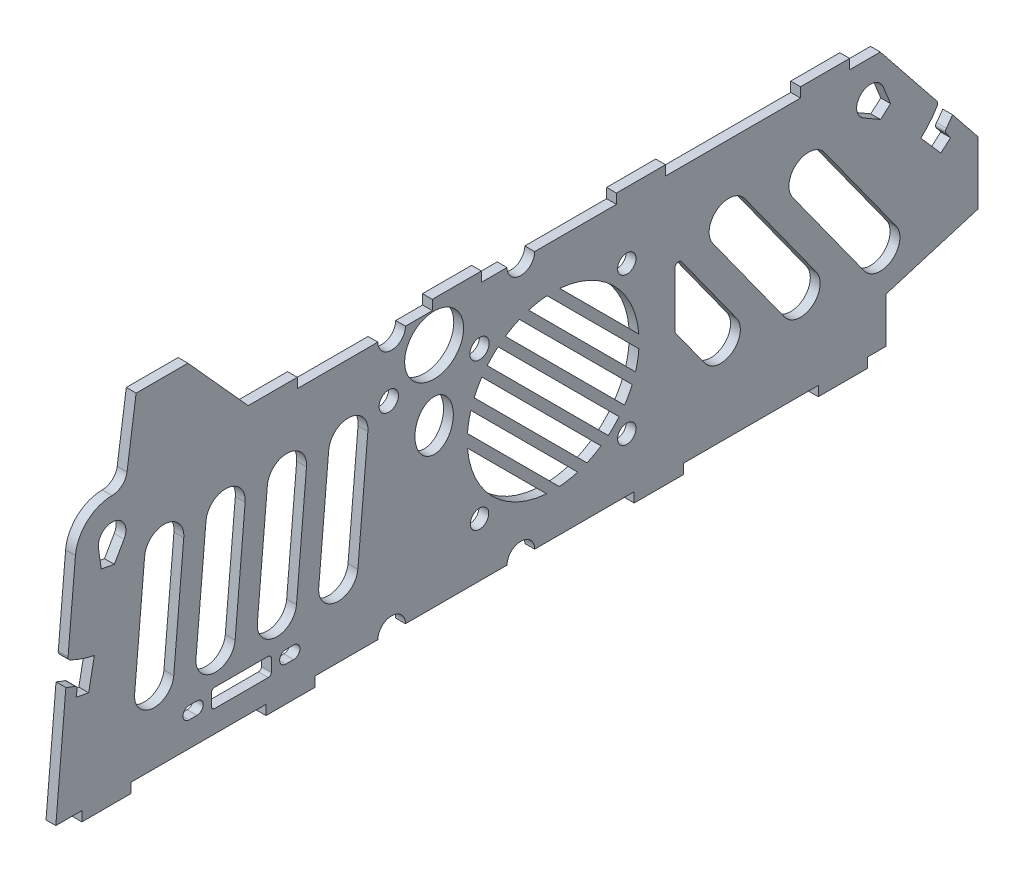
from build123d import *

# Parameters (mm, degrees)
EXTRUDE_1_DEPTH        = 1.6
SKETCH_2_W             = 8
SKETCH_2_H             = 1.6
EXTRUDE_3789_DEPTH     = 1.6
SKETCH_3901_R          = 1.575
SKETCH_3901_R_2        = 4.8
SKETCH_3901_RX         = 4.079397779
SKETCH_3901_RY         = 3.125
CUT_EXTRUDE_4345_DEPTH = 111.97882175
CUT_EXTRUDE_4991_DEPTH = 111.978821888
USB_C_DEPTH            = 111.978821888
SKETCH_4_R             = 1.5
CUT_EXTRUDE_6539_DEPTH = 111.978821888
FILLET_6578_R          = 0.6


with BuildPart() as part:
    # Sketch 258 → 凸台-拉伸1 (new body)
    with BuildSketch(Plane(origin=(0, 0, 0), x_dir=(0, 0, -1), z_dir=(1, 0, 0))):
        with BuildLine():
            Line((-95.02759931, 18.678130112), (-96.66172395, 0))
            Line((-96.66172395, 0), (-44.182229478, 0))
            ThreePointArc((-44.182229478, 0), (-41.932229478, 2.25), (-39.682229478, 0))
            Line((-39.682229478, 0), (-23.132229478, 0))
            ThreePointArc((-23.132229478, 0), (-20.882229478, 2.25), (-18.632229478, 0))
            Line((-18.632229478, 0), (38.58827605, 0))
            Line((38.58827605, 0), (38.58827605, 7.363667343))
            Line((38.58827605, 7.363667343), (53.613979238, 11.877821069))
            Line((53.613979238, 11.877821069), (53.613979238, 22.082386187))
            Line((53.613979238, 22.082386187), (49.47062371, 27.265958003))
            ThreePointArc((49.47062371, 27.265958003), (48.834122057, 26.360802519), (48.136507156, 25.501864655))
            Line((48.136507156, 25.501864655), (49.140587437, 24.184380908))
            Line((49.140587437, 24.184380908), (47.555615421, 22.806751165))
            Line((47.555615421, 22.806751165), (46.571594176, 23.938874033))
            Line((46.571594176, 23.938874033), (44.304779315, 26.546859335))
            ThreePointArc((44.304779315, 26.546859335), (45.901319607, 28.216879129), (47.163951689, 30.151735001))
            Line((47.163951689, 30.151735001), (38.58827605, 40.88038965))
            Line((38.58827605, 40.88038965), (37.693344157, 42))
            Line((37.693344157, 42), (-18.632229478, 42))
            ThreePointArc((-18.632229478, 42), (-20.882229478, 39.75), (-23.132229478, 42))
            Line((-23.132229478, 42), (-39.682229478, 42))
            ThreePointArc((-39.682229478, 42), (-41.932229478, 39.75), (-44.182229478, 42))
            Line((-44.182229478, 42), (-87.489213038, 42))
            ThreePointArc((-87.489213038, 42), (-91.542754284, 40.423664021), (-93.466381227, 36.522934456))
            Line((-93.466381227, 36.522934456), (-94.701678523, 22.403421746))
            ThreePointArc((-94.701678523, 22.403421746), (-92.600586212, 21.482408503), (-90.385935715, 20.883929203))
            Line((-90.385935715, 20.883929203), (-91.044661581, 17.446476624))
            Line((-91.044661581, 17.446476624), (-91.308151928, 16.071495593))
            Line((-91.308151928, 16.071495593), (-93.370623475, 16.466731113))
            Line((-93.370623475, 16.466731113), (-93.085096991, 17.956704104))
            ThreePointArc((-93.085096991, 17.956704104), (-94.06624713, 18.290763242), (-95.02759931, 18.678130112))
        make_face()
        with BuildLine():
            Line((-87.134291099, 32.113751112), (-88.194990752, 32.317015094))
            Line((-88.194990752, 32.317015094), (-89.255690405, 32.520279076))
            Line((-89.255690405, 32.520279076), (-89.715676025, 35.675403991))
            ThreePointArc((-89.715676025, 35.675403991), (-87.651937161, 38.244108032), (-85.239213038, 36))
            ThreePointArc((-85.239213038, 36), (-85.315834651, 35.417826153), (-85.540480938, 34.875303062))
            Line((-85.540480938, 34.875303062), (-87.134291099, 32.113751112))
        make_face(mode=Mode.SUBTRACT)
        with BuildLine():
            ThreePointArc((34.968023431, 34.04870964), (34.612244182, 37.698184303), (38.176585209, 36.837534989))
            Line((38.176585209, 36.837534989), (39.363457628, 33.878188125))
            Line((39.363457628, 33.878188125), (38.548329162, 33.169692829))
            Line((38.548329162, 33.169692829), (37.733200697, 32.461197532))
            Line((37.733200697, 32.461197532), (34.968023431, 34.04870964))
        make_face(mode=Mode.SUBTRACT)
    extrude(amount=EXTRUDE_1_DEPTH)

    # 草图2 → Extrude 3789 (add)
    with BuildSketch(Plane(origin=(0, 0, 0), x_dir=(0, 0, -1), z_dir=(1, 0, 0))):
        with Locations((31.58827605, -0.8)):
            Rectangle(SKETCH_2_W, SKETCH_2_H)
        with BuildLine():
            Line((-83.57773768, 54.5), (-85.058465214, 44.108922128))
            ThreePointArc((-85.058465214, 44.108922128), (-85.880169259, 42.600716396), (-87.489213038, 42))
            Line((-87.489213038, 42), (-65.306655843, 42))
            Line((-65.306655843, 42), (-57.306655843, 42))
            Line((-57.306655843, 42), (-57.306655843, 43.6))
            Line((-57.306655843, 43.6), (-65.306655843, 43.6))
            Line((-65.306655843, 43.6), (-75.139107316, 54.5))
            Line((-75.139107316, 54.5), (-83.57773768, 54.5))
        make_face()
        with Locations((1.58827605, -0.8)):
            Rectangle(SKETCH_2_W, SKETCH_2_H)
        with Locations((-58.41172395, -0.8)):
            Rectangle(SKETCH_2_W, SKETCH_2_H)
        with Locations((-88.41172395, -0.8)):
            Rectangle(SKETCH_2_W, SKETCH_2_H)
        with Locations((28.693344157, 42.8)):
            Rectangle(SKETCH_2_W, SKETCH_2_H)
        with Locations((-1.306655843, 42.8)):
            Rectangle(SKETCH_2_W, SKETCH_2_H)
        with Locations((-31.306655843, 42.8)):
            Rectangle(SKETCH_2_W, SKETCH_2_H)
    extrude(amount=EXTRUDE_3789_DEPTH)

    # Sketch 3901 → Cut-Extrude 4345 (cut, through all)
    with BuildSketch(Plane(origin=(1.6, 0, 0), x_dir=(0, 0, -1), z_dir=(1, 0, 0))):
        with Locations((-42.41172395, 32.797244765)):
            Circle(SKETCH_3901_R)
        with Locations((-27.61172395, 32.797244765)):
            Circle(SKETCH_3901_R)
        with Locations((-35.01172395, 37)):
            Circle(SKETCH_3901_R_2)
        with Locations(Location((-35.01172395, 25.645875517), (0, 0, 90))):
            Ellipse(SKETCH_3901_RX, SKETCH_3901_RY)
    extrude(amount=-CUT_EXTRUDE_4345_DEPTH, mode=Mode.SUBTRACT)

    # 草图3 → Cut-Extrude 4991 (cut, through all)
    with BuildSketch(Plane(origin=(1.6, 0, 0), x_dir=(0, 0, -1), z_dir=(1, 0, 0))):
        with BuildLine():
            Line((-75.812176966, 30.221101623), (-77.443840541, 11.571101623))
            ThreePointArc((-77.443840541, 11.571101623), (-80.910561952, 8.662176966), (-83.819486609, 12.128898377))
            Line((-83.819486609, 12.128898377), (-82.187823034, 30.778898377))
            ThreePointArc((-82.187823034, 30.778898377), (-78.721101623, 33.687823034), (-75.812176966, 30.221101623))
        make_face()
        with BuildLine():
            Line((28.597036742, 32.36959893), (40.282030055, 16.138119291))
            ThreePointArc((40.282030055, 16.138119291), (39.554592243, 11.671483618), (35.08795657, 12.398921431))
            Line((35.08795657, 12.398921431), (23.402963258, 28.63040107))
            ThreePointArc((23.402963258, 28.63040107), (24.13040107, 33.097036742), (28.597036742, 32.36959893))
        make_face()
        with BuildLine():
            Line((15.597036742, 32.36959893), (27.282030055, 16.138119291))
            ThreePointArc((27.282030055, 16.138119291), (26.554592243, 11.671483618), (22.08795657, 12.398921431))
            Line((22.08795657, 12.398921431), (10.402963258, 28.63040107))
            ThreePointArc((10.402963258, 28.63040107), (11.13040107, 33.097036742), (15.597036742, 32.36959893))
        make_face()
        with BuildLine():
            Line((-65.812176966, 30.221101623), (-67.443840541, 11.571101623))
            ThreePointArc((-67.443840541, 11.571101623), (-70.910561952, 8.662176966), (-73.819486609, 12.128898377))
            Line((-73.819486609, 12.128898377), (-72.187823034, 30.778898377))
            ThreePointArc((-72.187823034, 30.778898377), (-68.721101623, 33.687823034), (-65.812176966, 30.221101623))
        make_face()
        with BuildLine():
            Line((5.310202454, 28.600774008), (14.282030055, 16.138119291))
            ThreePointArc((14.282030055, 16.138119291), (13.554592243, 11.671483618), (9.08795657, 12.398921431))
            Line((9.08795657, 12.398921431), (4.336313675, 18.999369787))
            ThreePointArc((4.336313675, 18.999369787), (4.252221011, 19.16575476), (4.223258065, 19.349919586))
            Line((4.223258065, 19.349919586), (4.223258065, 28.250224209))
            ThreePointArc((4.223258065, 28.250224209), (4.639093238, 28.821261263), (5.310202454, 28.600774008))
        make_face()
        with BuildLine():
            Line((-55.812176966, 30.221101623), (-57.443840541, 11.571101623))
            ThreePointArc((-57.443840541, 11.571101623), (-60.910561952, 8.662176966), (-63.819486609, 12.128898377))
            Line((-63.819486609, 12.128898377), (-62.187823034, 30.778898377))
            ThreePointArc((-62.187823034, 30.778898377), (-58.721101623, 33.687823034), (-55.812176966, 30.221101623))
        make_face()
        with BuildLine():
            Line((-45.812176966, 30.221101623), (-47.443840541, 11.571101623))
            ThreePointArc((-47.443840541, 11.571101623), (-50.910561952, 8.662176966), (-53.819486609, 12.128898377))
            Line((-53.819486609, 12.128898377), (-52.187823034, 30.778898377))
            ThreePointArc((-52.187823034, 30.778898377), (-48.721101623, 33.687823034), (-45.812176966, 30.221101623))
        make_face()
    extrude(amount=-CUT_EXTRUDE_4991_DEPTH, mode=Mode.SUBTRACT)

    # Sketch1 → USB-C供电接口 (cut, through all)
    with BuildSketch(Plane(origin=(0, 0, 0), x_dir=(0, 0, -1), z_dir=(1, 0, 0))):
        with BuildLine():
            Line((-70.78672395, 6.588077), (-62.03672395, 6.588077))
            ThreePointArc((-62.03672395, 6.588077), (-61.68317056, 6.441630391), (-61.53672395, 6.088077))
            Line((-61.53672395, 6.088077), (-61.53672395, 4.088077))
            ThreePointArc((-61.53672395, 4.088077), (-61.68317056, 3.734523609), (-62.03672395, 3.588077))
            Line((-62.03672395, 3.588077), (-70.78672395, 3.588077))
            ThreePointArc((-70.78672395, 3.588077), (-71.140277341, 3.734523609), (-71.28672395, 4.088077))
            Line((-71.28672395, 4.088077), (-71.28672395, 6.088077))
            ThreePointArc((-71.28672395, 6.088077), (-71.140277341, 6.441630391), (-70.78672395, 6.588077))
        make_face()
        with BuildLine():
            Line((-73.66172395, 4.063077), (-74.91172395, 4.063077))
            ThreePointArc((-74.91172395, 4.063077), (-75.93672395, 5.088077), (-74.91172395, 6.113077))
            Line((-74.91172395, 6.113077), (-73.66172395, 6.113077))
            ThreePointArc((-73.66172395, 6.113077), (-72.63672395, 5.088077), (-73.66172395, 4.063077))
        make_face()
        with BuildLine():
            Line((-59.16172395, 4.063077), (-57.91172395, 4.063077))
            ThreePointArc((-57.91172395, 4.063077), (-56.88672395, 5.088077), (-57.91172395, 6.113077))
            Line((-57.91172395, 6.113077), (-59.16172395, 6.113077))
            ThreePointArc((-59.16172395, 6.113077), (-60.18672395, 5.088077), (-59.16172395, 4.063077))
        make_face()
    extrude(amount=USB_C_DEPTH, mode=Mode.SUBTRACT)

    # 草图4 → Cut-Extrude 6539 (cut, through all)
    with BuildSketch(Plane.ZY):
        with Locations((27.61172395, 32.797244765)):
            Circle(SKETCH_4_R)
        with Locations((3.61172395, 32.797244765)):
            Circle(SKETCH_4_R)
        with Locations((3.61172395, 8.797244765)):
            Circle(SKETCH_4_R)
        with Locations((27.61172395, 8.797244765)):
            Circle(SKETCH_4_R)
        with BuildLine():
            Line((4.867883577, 11.821171345), (24.58779737, 31.541085138))
            ThreePointArc((24.58779737, 31.541085138), (25.511218887, 30.696739702), (26.355564323, 29.773318185))
            Line((26.355564323, 29.773318185), (6.63565053, 10.053404392))
            ThreePointArc((6.63565053, 10.053404392), (5.712229014, 10.897749829), (4.867883577, 11.821171345))
        make_face()
        with BuildLine():
            Line((7.81555457, 9.168842338), (27.240126377, 28.593414145))
            ThreePointArc((27.240126377, 28.593414145), (27.915593881, 27.476674736), (28.484133017, 26.301886879))
            Line((28.484133017, 26.301886879), (10.107081836, 7.924835698))
            ThreePointArc((10.107081836, 7.924835698), (8.93229398, 8.493374835), (7.81555457, 9.168842338))
        make_face()
        with BuildLine():
            Line((11.623919235, 7.377207003), (29.031761713, 24.785049481))
            ThreePointArc((29.031761713, 24.785049481), (29.385414601, 23.304323916), (29.576199319, 21.793953181))
            Line((29.576199319, 21.793953181), (14.615015534, 6.832769396))
            ThreePointArc((14.615015534, 6.832769396), (13.1046448, 7.023554115), (11.623919235, 7.377207003))
        make_face()
        with BuildLine():
            Line((16.685170809, 6.838458577), (29.570510138, 19.723797906))
            ThreePointArc((29.570510138, 19.723797906), (29.163185197, 17.281864546), (28.332103839, 14.949857702))
            ThreePointArc((28.332103839, 14.949857702), (25.511218887, 10.897749829), (21.459111014, 8.076864876))
            ThreePointArc((21.459111014, 8.076864876), (19.12710417, 7.245783519), (16.685170809, 6.838458577))
        make_face()
        with BuildLine():
            Line((2.739314883, 15.292602651), (21.116366064, 33.669653832))
            ThreePointArc((21.116366064, 33.669653832), (22.291153921, 33.101114696), (23.40789333, 32.425647192))
            Line((23.40789333, 32.425647192), (3.983321523, 13.001075385))
            ThreePointArc((3.983321523, 13.001075385), (3.30785402, 14.117814795), (2.739314883, 15.292602651))
        make_face()
        with BuildLine():
            Line((1.647248581, 19.800536349), (16.608432366, 34.761720134))
            ThreePointArc((16.608432366, 34.761720134), (18.118803101, 34.570935416), (19.599528666, 34.217282528))
            Line((19.599528666, 34.217282528), (2.191686188, 16.80944005))
            ThreePointArc((2.191686188, 16.80944005), (1.8380333, 18.290165615), (1.647248581, 19.800536349))
        make_face()
        with BuildLine():
            Line((1.652937762, 21.870691624), (14.538277091, 34.756030953))
            ThreePointArc((14.538277091, 34.756030953), (12.096343731, 34.348706012), (9.764336886, 33.517624654))
            ThreePointArc((9.764336886, 33.517624654), (5.712229014, 30.696739702), (2.891344061, 26.644631829))
            ThreePointArc((2.891344061, 26.644631829), (2.060262704, 24.312624985), (1.652937762, 21.870691624))
        make_face()
    extrude(amount=-CUT_EXTRUDE_6539_DEPTH, mode=Mode.SUBTRACT)

    # Fillet 6578
    fillet_6578_edges = [part.edges().sort_by_distance(p)[0] for p in [
        (0.8, 17.956704104, 93.085096991),
        (0.8, 22.403421746, 94.701678523),
        (0.8, 30.151735001, -47.163951689),
        (0.8, 25.501864655, -48.136507156),
    ]]
    fillet(fillet_6578_edges, radius=FILLET_6578_R)


solid = part.part
